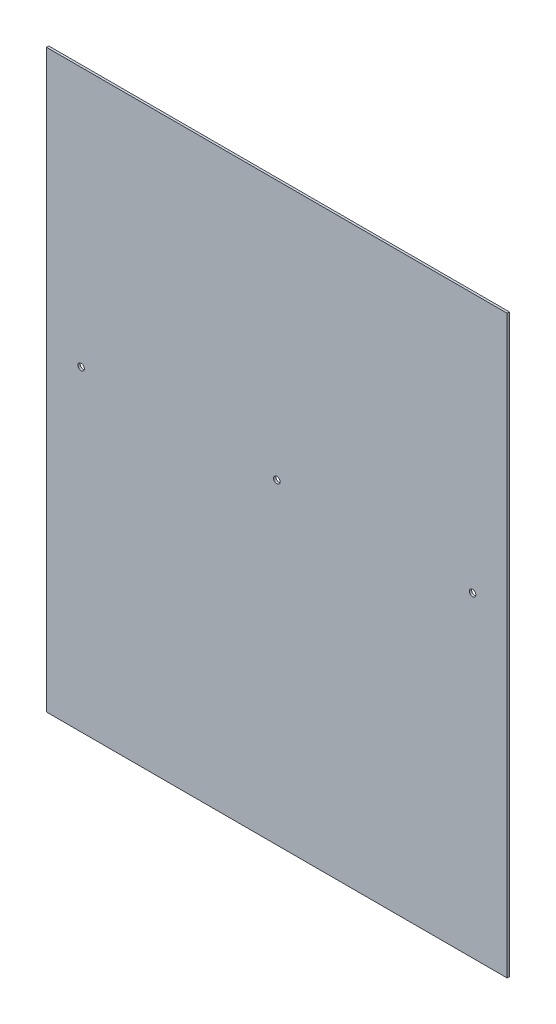
from build123d import *

# Parameters (mm, degrees)
SKETCH1_W           = 400
SKETCH1_H           = 500
BOSS_EXTRUDE1_DEPTH = 2
SKETCH3_R           = 2.821572875
CUT_EXTRUDE2_DEPTH  = 60


with BuildPart() as part:
    # Sketch1 → Boss-Extrude1 (new body)
    with BuildSketch(Plane.XY):
        Rectangle(SKETCH1_W, SKETCH1_H)
    extrude(amount=BOSS_EXTRUDE1_DEPTH)

    # Sketch3 → Cut-Extrude2 (cut)
    with BuildSketch(Plane(origin=(0, 7.541845926, 34), x_dir=(-1, 0, 0), z_dir=(0, 0, -1))):
        with Locations(Location((-170, 17, 0), (0, 0, 180))):
            Circle(SKETCH3_R)
        with Locations(Location((0, 17, 0), (0, 0, 180))):
            Circle(SKETCH3_R)
        with Locations(Location((170, 17, 0), (0, 0, 180))):
            Circle(SKETCH3_R)
    extrude(amount=CUT_EXTRUDE2_DEPTH, mode=Mode.SUBTRACT)


solid = part.part
